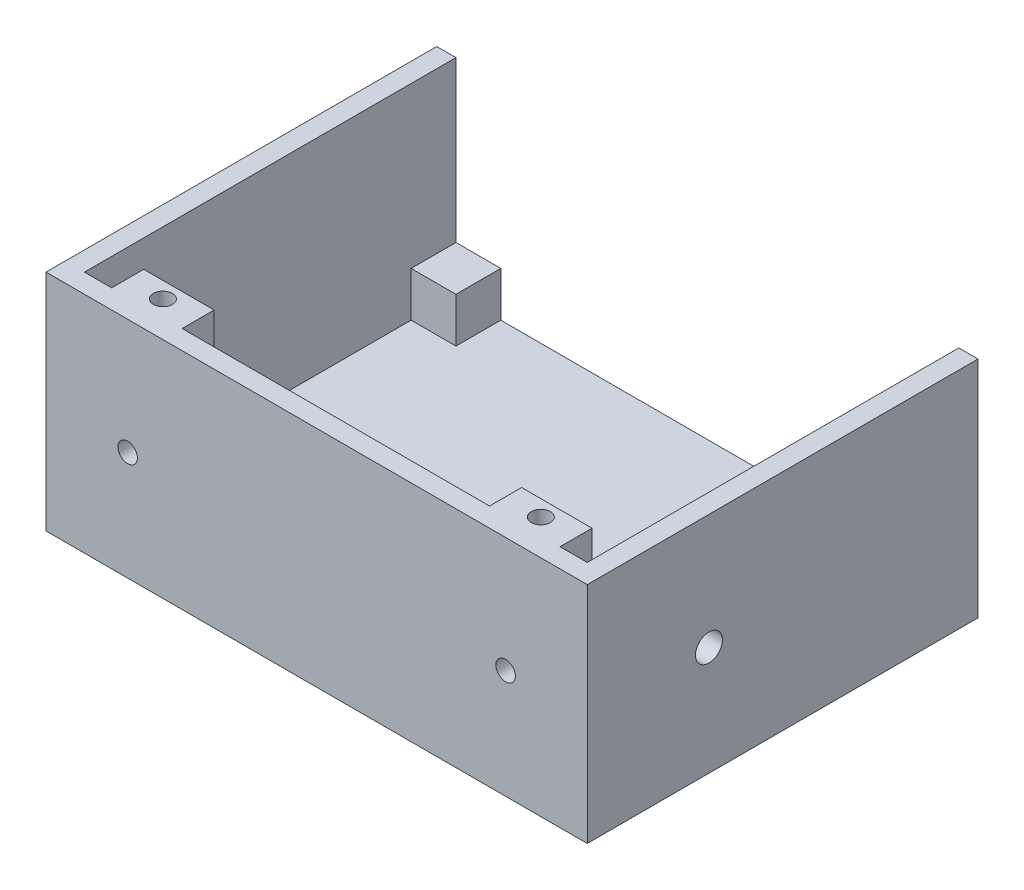
from build123d import *

# Parameters (mm, degrees)
SKETCH_1_R          = 1.52
EXTRUDE_2_DEPTH     = 3
SKETCH_2_W          = 84.5
SKETCH_2_H          = 3
EXTRUDE_3_DEPTH     = 58
SKETCH_3_W          = 3
SKETCH_3_H          = 32
EXTRUDE_4_DEPTH     = 58
SKETCH_5_R          = 2.1
CUT_EXTRUDE_1_DEPTH = 58
EXTRUDE_9_DEPTH     = 5
CUT_EXTRUDE_4_DEPTH = 4
SKETCH_15_W         = 7
SKETCH_15_H         = 7
EXTRUDE_10_DEPTH    = 7
CUT_EXTRUDE_5_DEPTH = 5


with BuildPart() as part:
    # 草图1 → 凸台-拉伸2 (new body)
    with BuildSketch(Plane.XY):
        Polygon((0, 0), (42.25, 0), (42.25, 35), (0, 35), (-42.25, 35), (-42.25, 0), align=None)
        with Locations((-29.5, 17)):
            Circle(SKETCH_1_R, mode=Mode.SUBTRACT)
        with Locations((29.5, 17)):
            Circle(SKETCH_1_R, mode=Mode.SUBTRACT)
    extrude(amount=EXTRUDE_2_DEPTH)

    # 草图2 → 凸台-拉伸3 (add)
    with BuildSketch(Plane(origin=(0, 0, 0), x_dir=(-1, 0, 0), z_dir=(0, 0, -1))):
        with Locations((0, 1.5)):
            Rectangle(SKETCH_2_W, SKETCH_2_H)
    extrude(amount=EXTRUDE_3_DEPTH)

    # 草图3 → 凸台-拉伸4 (add)
    with BuildSketch(Plane(origin=(0, 0, 0), x_dir=(-1, 0, 0), z_dir=(0, 0, -1))):
        with Locations((40.75, 19)):
            Rectangle(SKETCH_3_W, SKETCH_3_H)
        with Locations((-40.75, 19)):
            Rectangle(SKETCH_3_W, SKETCH_3_H)
    extrude(amount=EXTRUDE_4_DEPTH)

    # 草图5 → 切除-拉伸1 (cut)
    with BuildSketch(Plane(origin=(42.25, 0, 0), x_dir=(0, 0, -1), z_dir=(1, 0, 0))):
        with Locations((16, 17)):
            Circle(SKETCH_5_R)
    extrude(amount=-CUT_EXTRUDE_1_DEPTH, mode=Mode.SUBTRACT)

    # 草图12 → 凸台-拉伸9 (add)
    with BuildSketch(Plane(origin=(0, 0, 0), x_dir=(-1, 0, 0), z_dir=(0, 0, -1))):
        Polygon((-35, 28), (-35, 35), (-24, 35), (-24, 28), (-29.5, 28), align=None)
        Polygon((29.5, 28), (24, 28), (24, 35), (35, 35), (35, 28), align=None)
    extrude(amount=EXTRUDE_9_DEPTH)

    # 草图14 → 切除-拉伸4 (cut)
    with BuildSketch(Plane(origin=(0, 35, 0), x_dir=(1, 0, 0), z_dir=(0, 1, 0))):
        with BuildLine():
            ThreePointArc((-28.01, 2.5), (-29.184567453, 3.956228797), (-30.856446051, 3.116566387))
            Line((-30.856446051, 3.116566387), (-28.143553949, 1.883433613))
            ThreePointArc((-28.143553949, 1.883433613), (-28.043771203, 2.184567453), (-28.01, 2.5))
        make_face()
        with BuildLine():
            Line((-28.143553949, 1.883433613), (-30.856446051, 3.116566387))
            ThreePointArc((-30.856446051, 3.116566387), (-30.116566387, 1.143553949), (-28.143553949, 1.883433613))
        make_face()
        with BuildLine():
            ThreePointArc((30.99, 2.5), (29.815432547, 3.956228797), (28.143553949, 3.116566387))
            Line((28.143553949, 3.116566387), (30.856446051, 1.883433613))
            ThreePointArc((30.856446051, 1.883433613), (30.956228797, 2.184567453), (30.99, 2.5))
        make_face()
        with BuildLine():
            Line((30.856446051, 1.883433613), (28.143553949, 3.116566387))
            ThreePointArc((28.143553949, 3.116566387), (28.883433613, 1.143553949), (30.856446051, 1.883433613))
        make_face()
    extrude(amount=-CUT_EXTRUDE_4_DEPTH, mode=Mode.SUBTRACT)

    # 草图15 → 凸台-拉伸10 (add)
    with BuildSketch(Plane(origin=(0, 3, 0), x_dir=(1, 0, 0), z_dir=(0, 1, 0))):
        with Locations((35.75, 54.5)):
            Rectangle(SKETCH_15_W, SKETCH_15_H)
        with Locations((-35.75, 54.5)):
            Rectangle(SKETCH_15_W, SKETCH_15_H)
    extrude(amount=EXTRUDE_10_DEPTH)

    # 草图16 → 切除-拉伸5 (cut)
    with BuildSketch(Plane(origin=(0, 0, -58), x_dir=(-1, 0, 0), z_dir=(0, 0, -1))):
        with BuildLine():
            ThreePointArc((-34.26, 6.5), (-35.179801686, 7.876580503), (-36.803589104, 7.553589104))
            Line((-36.803589104, 7.553589104), (-34.696410896, 5.446410896))
            ThreePointArc((-34.696410896, 5.446410896), (-34.373419497, 5.929801686), (-34.26, 6.5))
        make_face()
        with BuildLine():
            Line((-34.696410896, 5.446410896), (-36.803589104, 7.553589104))
            ThreePointArc((-36.803589104, 7.553589104), (-36.803589104, 5.446410896), (-34.696410896, 5.446410896))
        make_face()
        with BuildLine():
            ThreePointArc((36.803589104, 7.553589104), (34.696410896, 7.553589104), (34.696410896, 5.446410896))
            Line((34.696410896, 5.446410896), (36.803589104, 7.553589104))
        make_face()
        with BuildLine():
            Line((36.803589104, 7.553589104), (34.696410896, 5.446410896))
            ThreePointArc((34.696410896, 5.446410896), (36.320198314, 5.123419497), (37.24, 6.5))
            ThreePointArc((37.24, 6.5), (37.126580503, 7.070198314), (36.803589104, 7.553589104))
        make_face()
    extrude(amount=-CUT_EXTRUDE_5_DEPTH, mode=Mode.SUBTRACT)


solid = part.part
